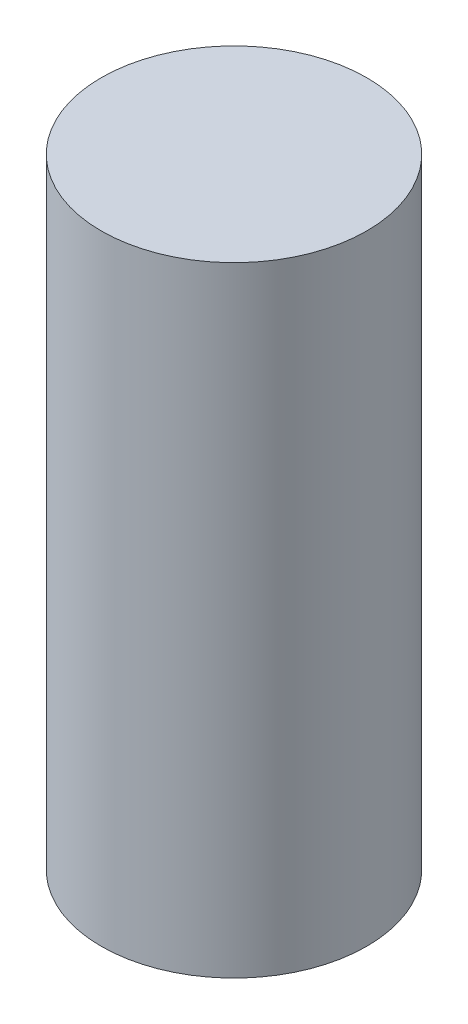
from build123d import *

# Parameters (mm, degrees)
OVEN_AYAR_MIL_1_START = 12
SKETCH1_R             = 6
OVEN_AYAR_MIL_1_DEPTH = 28


with BuildPart() as part:
    # Sketch1 → OVEN_ayar_mil_1 (new body)
    with BuildSketch(Plane(origin=(0, 0, 0), x_dir=(1, 0, 0), z_dir=(0, 1, 0)).offset(OVEN_AYAR_MIL_1_START)):
        with Locations(Location((50, 50, 0), (0, 0, 270))):
            Circle(SKETCH1_R)
    extrude(amount=OVEN_AYAR_MIL_1_DEPTH)


solid = part.part
